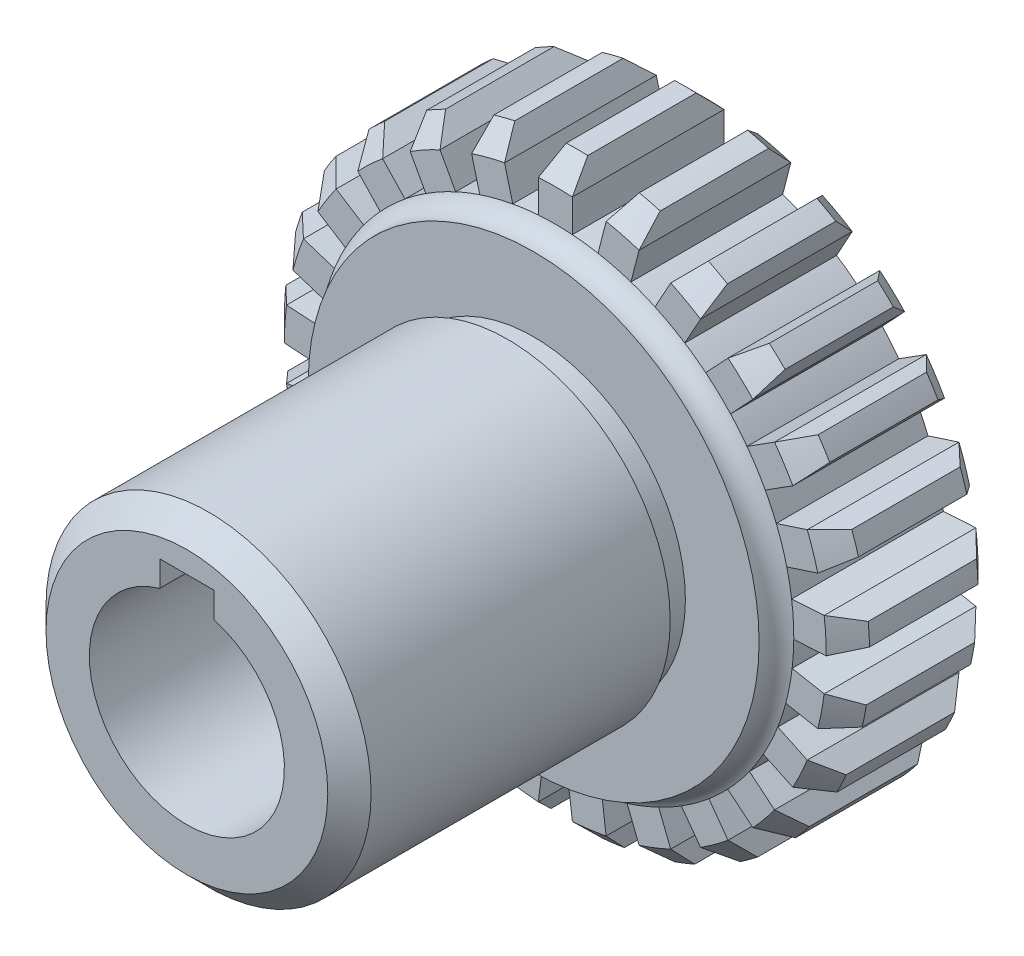
from build123d import *

# Parameters (mm, degrees)
CHAMFER_1_SIZE                       = 2
CUT_EXTRUDE_1_DEPTH                  = 58.201398584
EXTRUDE_START                        = -14
EXTRUDE_1_DEPTH                      = 14
CHAMFER_2_SIZE                       = 2
PATTERN_CIRCULAR_1_COUNT             = 25
CHAMFER_2_OF_PATTERN_CIRCULAR_1_SIZE = 2


with BuildPart() as part:
    # Эскиз1 → Повернуть1 (revolve)
    with BuildSketch(Plane(origin=(0, 0, 0), x_dir=(0, 0, -1), z_dir=(1, 0, 0)), mode=Mode.PRIVATE) as revolve_1_sk:
        with BuildLine():
            Line((-4.102897938, 0), (-4.102897938, 22))
            Line((-4.102897938, 22), (-18.102897938, 22))
            ThreePointArc((-18.102897938, 22), (-18.909863083, 21.078275241), (-20.102897938, 20.8))
            Line((-20.102897938, 20.8), (-20.102897938, 14))
            Line((-20.102897938, 14), (-22.502897938, 14))
            Line((-22.502897938, 14), (-22.502897938, 15))
            Line((-22.502897938, 15), (-52.102897938, 15))
            Line((-52.102897938, 15), (-52.102897938, 0))
            Line((-52.102897938, 0), (-4.102897938, 0))
        make_face()
    revolve(revolve_1_sk.sketch.rotate(Axis((0, 0, 52.102897938), (0, 0, -1)), 90), axis=Axis((0, 0, 52.102897938), (0, 0, -1)))

    # Фаска1
    chamfer_1_edges = [part.edges().sort_by_distance(p)[0] for p in [
        (-15, 0, 52.102897938),
    ]]
    chamfer(chamfer_1_edges, length=CHAMFER_1_SIZE)

    # Эскиз2 → Вырез-Вытянуть1 (cut, through all)
    with BuildSketch(Plane(origin=(0, 0, 4.102897938), x_dir=(-1, 0, 0), z_dir=(0, 0, -1))):
        with BuildLine():
            Line((-2.5, 11), (-2.5, 8.645808233))
            ThreePointArc((-2.5, 8.645808233), (0, -9), (2.5, 8.645808233))
            Line((2.5, 8.645808233), (2.5, 11))
            Line((2.5, 11), (-2.5, 11))
        make_face()
    extrude(amount=-CUT_EXTRUDE_1_DEPTH, mode=Mode.SUBTRACT)

    # Эскиз3 → Вырез-Повернуть1 (revolve, cut)
    with BuildSketch(Plane(origin=(0, 0, 0), x_dir=(0, 0, -1), z_dir=(1, 0, 0)), mode=Mode.PRIVATE) as cut_revolve_1_sk:
        Polygon((-4.102897938, 9), (-4.102897938, 12), (-8.102897938, 9), align=None)
    revolve(cut_revolve_1_sk.sketch.rotate(Axis((0, 0, 0), (0, 0, 1)), 90), axis=Axis((0, 0, 0), (0, 0, 1)), mode=Mode.SUBTRACT)

    # Эскиз4 → Бобышка-Вытянуть1 (add)
    with BuildSketch(Plane(origin=(0, 0, 4.102897938), x_dir=(-1, 0, 0), z_dir=(0, 0, -1)).offset(EXTRUDE_START)):
        with BuildLine():
            Line((-1.569762662, 24.950668231), (-1.569762662, 21.943925018))
            ThreePointArc((-1.569762662, 21.943925018), (0, 22), (1.569762662, 21.943925018))
            Line((1.569762662, 21.943925018), (1.569762662, 24.950668231))
            Line((1.569762662, 24.950668231), (0.994347584, 26.981684026))
            ThreePointArc((0.994347584, 26.981684026), (0, 27), (-0.994347584, 26.981684026))
            Line((-0.994347584, 26.981684026), (-1.569762662, 24.950668231))
        make_face()
    extrude_1 = extrude(amount=EXTRUDE_1_DEPTH)

    # Фаска2
    chamfer_2_edges = [part.edges().sort_by_distance(p)[0] for p in [
        (0, 27, 18.102897938),
        (0, 27, 4.102897938),
    ]]
    chamfer(chamfer_2_edges, length=CHAMFER_2_SIZE)

    # Круговой массив1: Бобышка-Вытянуть1 ×25 about axis
    pattern_circular_1_axis = Axis((0, 0, 0), (0, 0, 1))
    for i in range(1, PATTERN_CIRCULAR_1_COUNT):
        add(extrude_1.rotate(pattern_circular_1_axis, i * 360 / PATTERN_CIRCULAR_1_COUNT))

    # Фаска2 of Круговой массив1
    chamfer_2_of_pattern_circular_1_edges = [part.edges().sort_by_distance(p)[0] for p in [
        (-6.714626953, 26.15174535, 18.102897938),
        (-6.714626953, 26.15174535, 4.102897938),
        (-13.007349201, 23.660280361, 18.102897938),
        (-13.007349201, 23.660280361, 4.102897938),
        (-18.48277186, 19.68215294, 18.102897938),
        (-18.48277186, 19.68215294, 4.102897938),
        (-22.796853989, 14.467323464, 18.102897938),
        (-22.796853989, 14.467323464, 4.102897938),
        (-25.67852594, 8.343458848, 18.102897938),
        (-25.67852594, 8.343458848, 4.102897938),
        (-26.946721668, 1.695344027, 18.102897938),
        (-26.946721668, 1.695344027, 4.102897938),
        (-26.52175577, -5.059295494, 18.102897938),
        (-26.52175577, -5.059295494, 4.102897938),
        (-24.430330417, -11.496040872, 18.102897938),
        (-24.430330417, -11.496040872, 4.102897938),
        (-20.803857555, -17.210447723, 18.102897938),
        (-20.803857555, -17.210447723, 4.102897938),
        (-15.870201812, -21.843458848, 18.102897938),
        (-15.870201812, -21.843458848, 4.102897938),
        (-9.939362922, -25.103965119, 18.102897938),
        (-9.939362922, -25.103965119, 4.102897938),
        (-3.383997306, -26.787096935, 18.102897938),
        (-3.383997306, -26.787096935, 4.102897938),
        (3.383997306, -26.787096935, 18.102897938),
        (3.383997306, -26.787096935, 4.102897938),
        (9.939362922, -25.103965119, 18.102897938),
        (9.939362922, -25.103965119, 4.102897938),
        (15.870201812, -21.843458848, 18.102897938),
        (15.870201812, -21.843458848, 4.102897938),
        (20.803857555, -17.210447723, 18.102897938),
        (20.803857555, -17.210447723, 4.102897938),
        (24.430330417, -11.496040872, 18.102897938),
        (24.430330417, -11.496040872, 4.102897938),
        (26.52175577, -5.059295494, 18.102897938),
        (26.52175577, -5.059295494, 4.102897938),
        (26.946721668, 1.695344027, 18.102897938),
        (26.946721668, 1.695344027, 4.102897938),
        (25.67852594, 8.343458848, 18.102897938),
        (25.67852594, 8.343458848, 4.102897938),
        (22.796853989, 14.467323464, 18.102897938),
        (22.796853989, 14.467323464, 4.102897938),
        (18.48277186, 19.68215294, 18.102897938),
        (18.48277186, 19.68215294, 4.102897938),
        (13.007349201, 23.660280361, 18.102897938),
        (13.007349201, 23.660280361, 4.102897938),
        (6.714626953, 26.15174535, 18.102897938),
        (6.714626953, 26.15174535, 4.102897938),
    ]]
    chamfer(chamfer_2_of_pattern_circular_1_edges, length=CHAMFER_2_OF_PATTERN_CIRCULAR_1_SIZE)


solid = part.part
